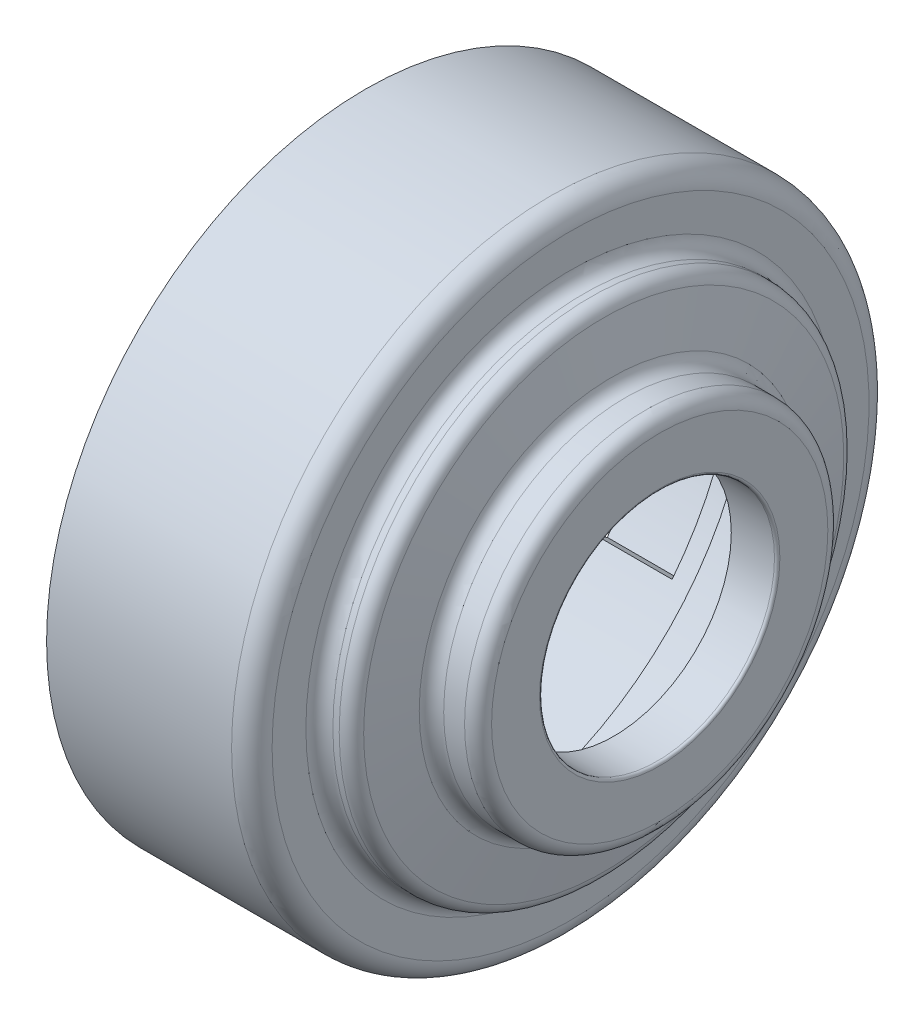
from build123d import *

# Parameters (mm, degrees)
FILLET_1_R               = 0.2
FILLET_2_R               = 1
FILLET_3_R               = 1.5
CUT_EXTRUDE_START        = -1
CUT_EXTRUDE_1_DEPTH      = 1
CUT_EXTRUDE_START_2      = -5.5
CUT_EXTRUDE_2_DEPTH      = 5.5
SKETCH_5_W               = 2.200000000000001
SKETCH_5_H               = 1.458146796235166
CUT_REVOLVE_1_ANGLE      = 24.000000000000053
CUT_EXTRUDE_3_REACH      = 51.835
CUT_EXTRUDE_3_END_RADIUS = 22.8
PATTERN_CIRCULAR_1_COUNT = 3
CUT_EXTRUDE_5_REACH      = 40.16
PATTERN_CIRCULAR_3_COUNT = 3
CUT_EXTRUDE_6_REACH      = 40.16
CUT_EXTRUDE_7_REACH      = 40.16


with BuildPart() as part:
    # 草图2 → 旋转1 (revolve)
    with BuildSketch(Plane.XY, mode=Mode.PRIVATE) as revolve_1_sk:
        Polygon((-13.999999999999998, 22), (-6.899999999999999, 22), (-6.899999999999999, 21.599999999999998), (1.73e-15, 21.599999999999998), (2.28e-15, 17.4), (2.500000000000002, 17.4), (3.4080839506486016, 12.25), (6.600000000000003, 12.25), (6.600000000000003, 9.4), (4.400000000000003, 9.4), (4.400000000000003, 8.700000000000001), (7.800000000000003, 8.700000000000001), (7.800000000000003, 13.45), (4.415003508061337, 13.45), (3.506919557412737, 18.599999999999998), (1.200000000000002, 18.599999999999998), (1.2000000000000015, 23.599999999999998), (-13.999999999999998, 23.599999999999998), align=None)
    revolve(revolve_1_sk.sketch.rotate(Axis((-36.93660531697341, 0, 0), (1, 0, 0)), 90), axis=Axis((-36.93660531697341, 0, 0), (1, 0, 0)))

    # 圆角1
    fillet_1_edges = [part.edges().sort_by_distance(p)[0] for p in [
        (0, 4.55e-15, -21.599999999999998),
        (0, -4.06e-15, -17.4),
        (2.5, -4.06e-15, -17.4),
        (6.600000000000001, -2.86e-15, -12.25),
        (7.800000000000004, -2.03e-15, -8.700000000000001),
    ]]
    fillet(fillet_1_edges, radius=FILLET_1_R)

    # 圆角2
    fillet_2_edges = [part.edges().sort_by_distance(p)[0] for p in [
        (7.800000000000004, -3.14e-15, -13.45),
        (4.415003508061339, -3.14e-15, -13.45),
        (3.5069195574127363, -4.34e-15, -18.599999999999998),
        (1.2000000000000028, -4.34e-15, -18.599999999999998),
    ]]
    fillet(fillet_2_edges, radius=FILLET_2_R)

    # 圆角3
    fillet_3_edges = [part.edges().sort_by_distance(p)[0] for p in [
        (3.408083950648603, -2.86e-15, -12.25),
        (1.2000000000000028, -5.51e-15, -23.599999999999998),
    ]]
    fillet(fillet_3_edges, radius=FILLET_3_R)

    # 草图3 → 切除-拉伸1 (cut)
    with BuildSketch(Plane.ZY.offset(13.999999999999998).offset(CUT_EXTRUDE_START)):
        with BuildLine():
            Line((-0.49999999999999933, 22.599999999999998), (0.5000000000000004, 22.599999999999998))
            Line((0.5000000000000004, 22.599999999999998), (0.5000000000000006, 21.99431744792277))
            ThreePointArc((0.5000000000000006, 21.99431744792277), (1.35e-15, 22), (-0.4999999999999993, 21.99431744792277))
            Line((-0.4999999999999993, 21.99431744792277), (-0.49999999999999933, 22.599999999999998))
        make_face()
    extrude(amount=CUT_EXTRUDE_1_DEPTH, mode=Mode.SUBTRACT)

    # 草图4 → 切除-拉伸2 (cut)
    with BuildSketch(Plane.ZY.offset(13.999999999999998).offset(CUT_EXTRUDE_START_2)):
        with BuildLine():
            Line((-3.2499999999999982, 22.56717749298747), (-3.2499999999999987, 21.75861898191151))
            ThreePointArc((-3.2499999999999987, 21.75861898191151), (1.35e-15, 21.999999999999996), (3.2500000000000013, 21.75861898191151))
            Line((3.2500000000000013, 21.75861898191151), (3.2500000000000018, 22.567177492987465))
            ThreePointArc((3.2500000000000018, 22.567177492987465), (1.4e-15, 22.8), (-3.2499999999999982, 22.56717749298747))
        make_face()
    cut_extrude_2 = extrude(amount=CUT_EXTRUDE_2_DEPTH, mode=Mode.SUBTRACT)

    # 草图5 → 切除-旋转1 (revolve, cut)
    with BuildSketch(Plane.XY):
        with Locations((-9.599999999999994, 22.070926601882412)):
            Rectangle(SKETCH_5_W, SKETCH_5_H)
    cut_revolve_1 = revolve(axis=Axis((16.624194515447005, 0, 0), (1, 0, 0)), revolution_arc=CUT_REVOLVE_1_ANGLE, mode=Mode.SUBTRACT)

    # 切除-拉伸3: up to this cylinder (the profile starts inside it)
    cut_extrude_3_end = Plane(origin=(-10.733154, 0, 0), z_dir=(-1, 0, 0)) * Cylinder(CUT_EXTRUDE_3_END_RADIUS, 150.27, mode=Mode.PRIVATE)
    # 草图6 → 切除-拉伸3 (cut, up to the surface)
    with BuildSketch(Plane(origin=(0, 18, 0), x_dir=(1, 0, 0), z_dir=(0, 1, 0)), mode=Mode.PRIVATE) as cut_extrude_3_sk1:
        Polygon((-10.699999999999994, -8.948206147667621), (-10.699999999999994, -3.2500000000000013), (-10.799462558281862, -8.948206147667621), align=None)
    cut_extrude_3_tool1 = extrude(cut_extrude_3_sk1.sketch, amount=CUT_EXTRUDE_3_REACH, mode=Mode.PRIVATE) & cut_extrude_3_end
    cut_extrude_3 = cut_extrude_3_tool1.solids().sort_by_distance((-10.733154, 18, 7.048804))[0]
    add(cut_extrude_3, mode=Mode.SUBTRACT)

    # 阵列(圆周)1: 切除-拉伸2, 切除-旋转1 ×3 about axis
    pattern_circular_1_axis = Axis((0, 5e-17, 2e-16), (1, 0, 0))
    add([cut_extrude_2.rotate(pattern_circular_1_axis, i * 360 / PATTERN_CIRCULAR_1_COUNT) for i in range(1, PATTERN_CIRCULAR_1_COUNT)], mode=Mode.SUBTRACT)
    add([cut_revolve_1.rotate(pattern_circular_1_axis, i * 360 / PATTERN_CIRCULAR_1_COUNT) for i in range(1, PATTERN_CIRCULAR_1_COUNT)], mode=Mode.SUBTRACT)

    # 切除-拉伸5: up to this face of the body (flat: up to its plane)
    cut_extrude_5_end = Plane(part.part.faces().sort_by_distance((-10.750360581, 21.4748312, 6.135155752))[0])
    # 草图9 → 切除-拉伸5 (cut, up to the picked face)
    with BuildSketch(Plane(origin=(-10.699999999999994, 0, 0), x_dir=(0, 0, -1), z_dir=(1, 0, 0)), mode=Mode.PRIVATE) as cut_extrude_5_sk1:
        with BuildLine():
            Line((-9.273595462128261, 20.82883643425129), (-8.948206147667621, 20.09800006813721))
            Line((-8.948206147667621, 20.09800006813721), (-8.948206147667618, 20.970684460428163))
            ThreePointArc((-8.948206147667618, 20.970684460428163), (-9.111176855506788, 20.90039368786333), (-9.273595462128261, 20.82883643425129))
        make_face()
    cut_extrude_5_tool1 = split(extrude(cut_extrude_5_sk1.sketch, amount=-CUT_EXTRUDE_5_REACH, mode=Mode.PRIVATE), bisect_by=cut_extrude_5_end, keep=Keep.BOTH, mode=Mode.PRIVATE)
    add(cut_extrude_5_tool1.solids().sort_by(Axis((-10.7, 20.632815, 9.056732), (-1, 0, 0)))[0], mode=Mode.SUBTRACT)

    # 阵列(圆周)3: 切除-拉伸3 ×3 about axis
    pattern_circular_3_axis = Axis((0, 0, 3e-17), (1, 0, 0))
    for i in range(1, PATTERN_CIRCULAR_3_COUNT):
        add(cut_extrude_3.rotate(pattern_circular_3_axis, i * 360 / PATTERN_CIRCULAR_3_COUNT), mode=Mode.SUBTRACT)

    # 切除-拉伸6: up to this face of the body (flat: up to its plane)
    cut_extrude_6_end = Plane(part.part.faces().sort_by_distance((-10.750360581, -5.424214863, -21.665327237))[0])
    # 草图10 → 切除-拉伸6 (cut, up to the picked face)
    with BuildSketch(Plane(origin=(-10.699999999999994, 0, 0), x_dir=(0, 0, -1), z_dir=(1, 0, 0)), mode=Mode.PRIVATE) as cut_extrude_6_sk1:
        with BuildLine():
            Line((22.675099214396656, -2.383248962502268), (21.879481698102033, -2.2996261918881546))
            Line((21.879481698102033, -2.2996261918881546), (22.63524855131219, -2.7359683880336263))
            ThreePointArc((22.63524855131219, -2.7359683880336263), (22.655860310538994, -2.5596862286897593), (22.675099214396656, -2.383248962502268))
        make_face()
    cut_extrude_6_tool1 = split(extrude(cut_extrude_6_sk1.sketch, amount=-CUT_EXTRUDE_6_REACH, mode=Mode.PRIVATE), bisect_by=cut_extrude_6_end, keep=Keep.BOTH, mode=Mode.PRIVATE)
    add(cut_extrude_6_tool1.solids().sort_by(Axis((-10.7, -2.473048, -22.396907), (-1, 0, 0)))[0], mode=Mode.SUBTRACT)

    # 切除-拉伸7: up to this face of the body (flat: up to its plane)
    cut_extrude_7_end = Plane(part.part.faces().sort_by_distance((-10.750360581, -16.050616337, 15.530171486))[0])
    # 草图11 → 切除-拉伸7 (cut, up to the picked face)
    with BuildSketch(Plane(origin=(-10.699999999999994, 0, 0), x_dir=(0, 0, -1), z_dir=(1, 0, 0)), mode=Mode.PRIVATE) as cut_extrude_7_sk1:
        with BuildLine():
            Line((-13.401503752268288, -18.445587471748876), (-12.93127555043432, -17.79837387624892))
            Line((-12.93127555043432, -17.79837387624892), (-13.687042403644462, -18.234716072394395))
            ThreePointArc((-13.687042403644462, -18.234716072394395), (-13.5446834550321, -18.340707459173426), (-13.401503752268288, -18.445587471748876))
        make_face()
    cut_extrude_7_tool1 = split(extrude(cut_extrude_7_sk1.sketch, amount=-CUT_EXTRUDE_7_REACH, mode=Mode.PRIVATE), bisect_by=cut_extrude_7_end, keep=Keep.BOTH, mode=Mode.PRIVATE)
    add(cut_extrude_7_tool1.solids().sort_by(Axis((-10.7, -18.159767, 13.340176), (-1, 0, 0)))[0], mode=Mode.SUBTRACT)


solid = part.part
